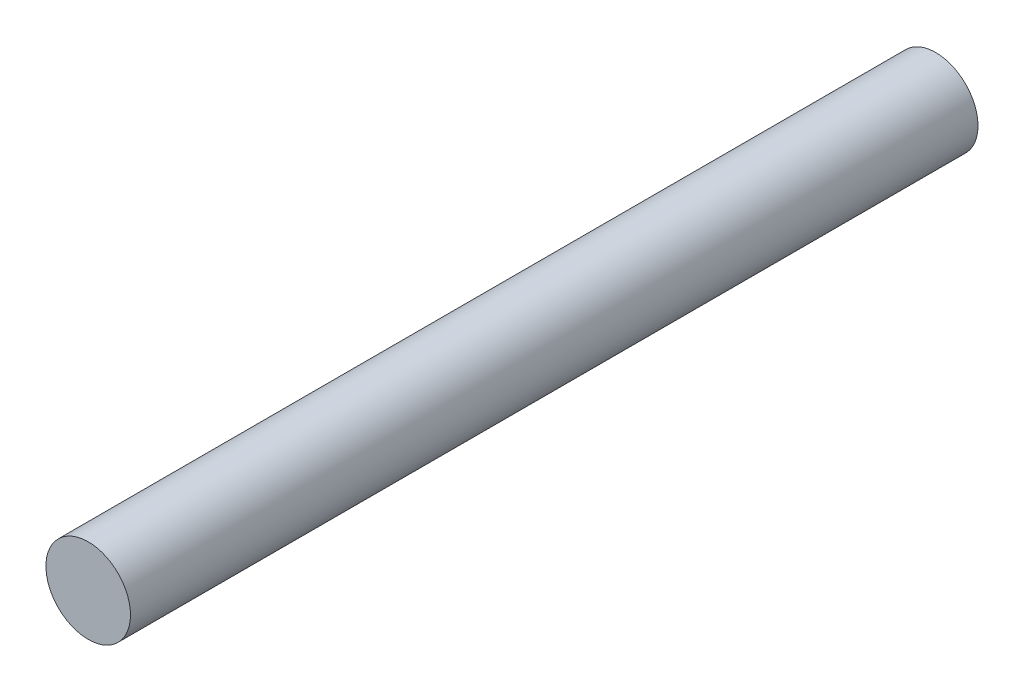
from build123d import *

# Parameters (mm, degrees)
SKETCH_1_R                        = 2
DRIVER_POWER_CABLE_ENVELOPE_DEPTH = 40.08


with BuildPart() as part:
    # 草图1 → Driver_power_cable_envelope (new body)
    with BuildSketch(Plane.XY):
        Circle(SKETCH_1_R)
    extrude(amount=DRIVER_POWER_CABLE_ENVELOPE_DEPTH)


solid = part.part
